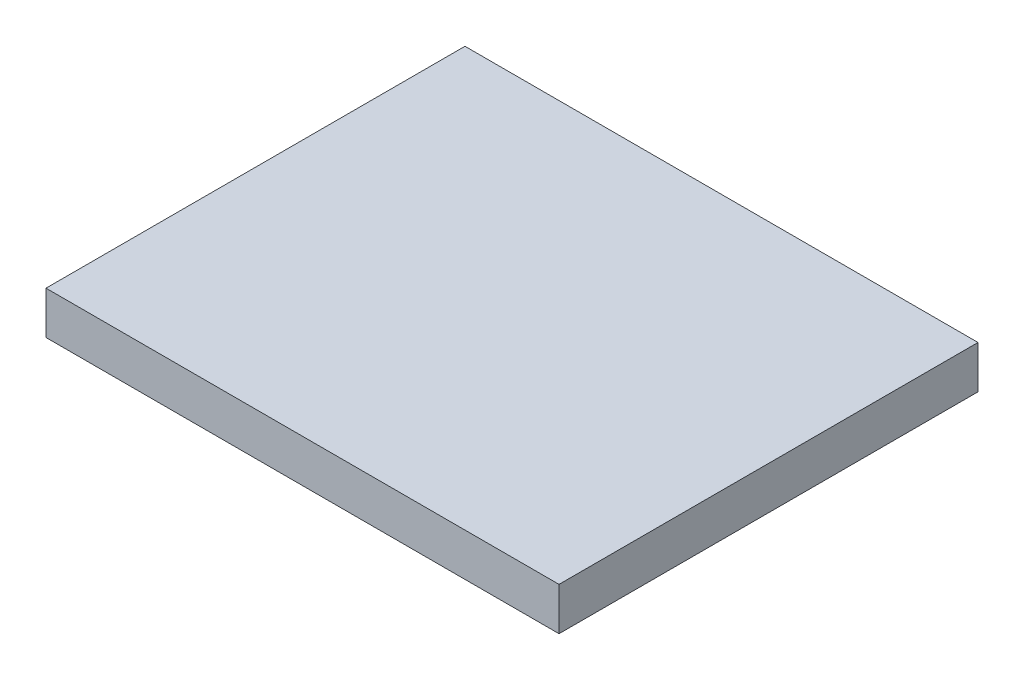
from build123d import *

# Parameters (mm, degrees)
SKETCH1_W           = 120
SKETCH1_H           = 98
BOSS_EXTRUDE1_DEPTH = 10


with BuildPart() as part:
    # Sketch1 → Boss-Extrude1 (new body)
    with BuildSketch(Plane(origin=(0, 0, 0), x_dir=(1, 0, 0), z_dir=(0, 1, 0))):
        Rectangle(SKETCH1_W, SKETCH1_H)
    extrude(amount=BOSS_EXTRUDE1_DEPTH)


solid = part.part
